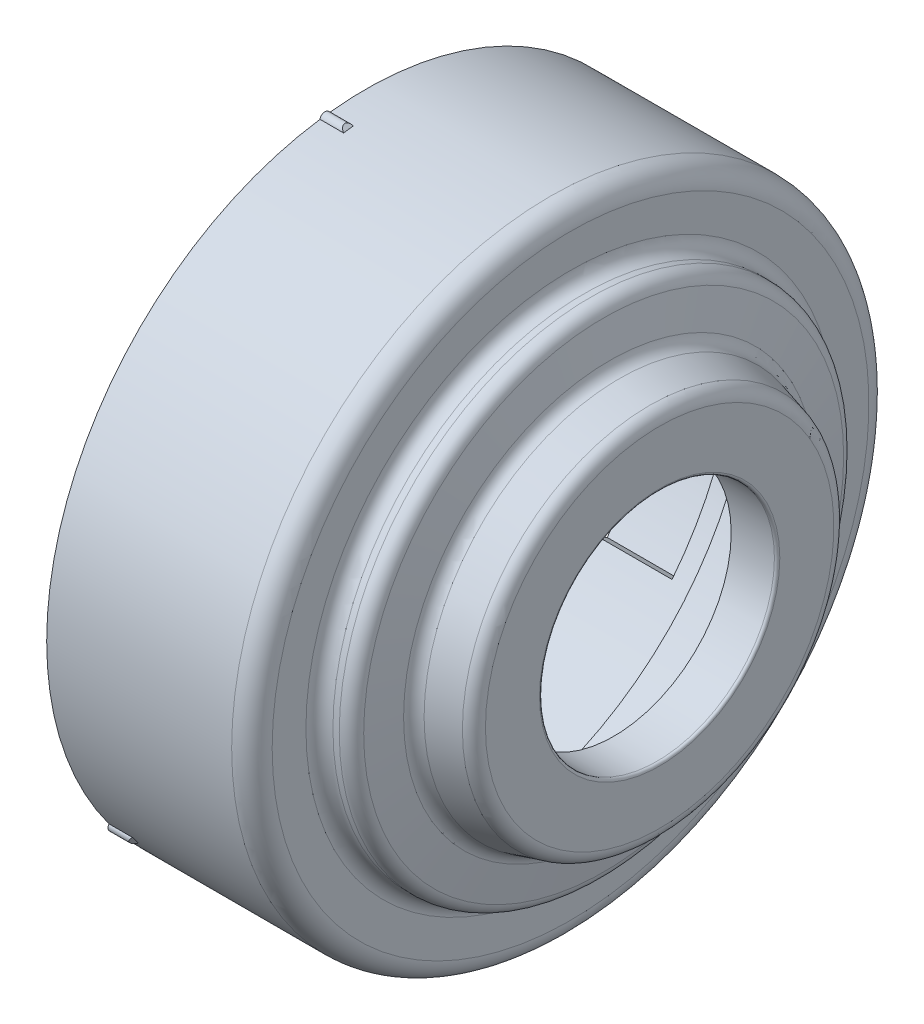
from build123d import *

# Parameters (mm, degrees)
FILLET_1_R               = 0.2
FILLET_2_R               = 1
FILLET_3_R               = 1.5
CUT_EXTRUDE_START        = -1
CUT_EXTRUDE_1_DEPTH      = 1
CUT_EXTRUDE_START_2      = -5.5
CUT_EXTRUDE_2_DEPTH      = 5.5
SKETCH_5_W               = 2.200000000000001
SKETCH_5_H               = 1.458146796235166
CUT_REVOLVE_1_ANGLE      = 24.000000000000053
CUT_EXTRUDE_3_REACH      = 51.835
CUT_EXTRUDE_3_END_RADIUS = 22.8
PATTERN_CIRCULAR_1_COUNT = 3
CUT_EXTRUDE_5_REACH      = 40.16
PATTERN_CIRCULAR_3_COUNT = 3
CUT_EXTRUDE_6_REACH      = 40.16
CUT_EXTRUDE_7_REACH      = 40.16
EXTRUDE_2_DEPTH          = 1.75
PATTERN_CIRCULAR_7_COUNT = 3


with BuildPart() as part:
    # 草图2 → 旋转1 (revolve)
    with BuildSketch(Plane.XY, mode=Mode.PRIVATE) as revolve_1_sk:
        Polygon((-13.999999999999998, 22), (-6.899999999999999, 22), (-6.899999999999999, 21.599999999999998), (1.73e-15, 21.599999999999998), (2.28e-15, 17.4), (2.500000000000002, 17.4), (3.157262574057294, 13.672478713033763), (6.600000000000001, 12.75), (6.600000000000003, 9.4), (4.400000000000003, 9.4), (4.400000000000003, 8.700000000000001), (7.800000000000003, 8.700000000000001), (7.800000000000003, 13.670792385574746), (4.206280569869923, 14.633726604702153), (3.506919557412737, 18.599999999999998), (1.200000000000002, 18.599999999999998), (1.2000000000000015, 23.599999999999998), (-13.999999999999998, 23.599999999999998), align=None)
    revolve(revolve_1_sk.sketch.rotate(Axis((-36.93660531697341, 0, 0), (1, 0, 0)), 90), axis=Axis((-36.93660531697341, 0, 0), (1, 0, 0)))

    # 圆角1
    fillet_1_edges = [part.edges().sort_by_distance(p)[0] for p in [
        (0, 4.55e-15, -21.599999999999998),
        (0, -4.06e-15, -17.4),
        (2.5, -4.06e-15, -17.4),
        (6.600000000000001, -2.98e-15, -12.75),
        (7.800000000000004, -2.03e-15, -8.700000000000001),
    ]]
    fillet(fillet_1_edges, radius=FILLET_1_R)

    # 圆角2
    fillet_2_edges = [part.edges().sort_by_distance(p)[0] for p in [
        (7.800000000000004, -3.19e-15, -13.670792385574746),
        (4.206280569869925, -3.42e-15, -14.633726604702153),
        (3.5069195574127363, -4.34e-15, -18.599999999999998),
        (1.2000000000000028, -4.34e-15, -18.599999999999998),
    ]]
    fillet(fillet_2_edges, radius=FILLET_2_R)

    # 圆角3
    fillet_3_edges = [part.edges().sort_by_distance(p)[0] for p in [
        (3.1572625740572917, -3.19e-15, -13.672478713033763),
        (1.2000000000000028, -5.51e-15, -23.599999999999998),
    ]]
    fillet(fillet_3_edges, radius=FILLET_3_R)

    # 草图3 → 切除-拉伸1 (cut)
    with BuildSketch(Plane.ZY.offset(13.999999999999998).offset(CUT_EXTRUDE_START)):
        with BuildLine():
            Line((-0.49999999999999933, 22.599999999999998), (0.5000000000000004, 22.599999999999998))
            Line((0.5000000000000004, 22.599999999999998), (0.5000000000000006, 21.99431744792277))
            ThreePointArc((0.5000000000000006, 21.99431744792277), (1.35e-15, 22), (-0.4999999999999993, 21.99431744792277))
            Line((-0.4999999999999993, 21.99431744792277), (-0.49999999999999933, 22.599999999999998))
        make_face()
    extrude(amount=CUT_EXTRUDE_1_DEPTH, mode=Mode.SUBTRACT)

    # 草图4 → 切除-拉伸2 (cut)
    with BuildSketch(Plane.ZY.offset(13.999999999999998).offset(CUT_EXTRUDE_START_2)):
        with BuildLine():
            Line((-3.2499999999999982, 22.56717749298747), (-3.2499999999999987, 21.75861898191151))
            ThreePointArc((-3.2499999999999987, 21.75861898191151), (1.35e-15, 21.999999999999996), (3.2500000000000013, 21.75861898191151))
            Line((3.2500000000000013, 21.75861898191151), (3.2500000000000018, 22.567177492987465))
            ThreePointArc((3.2500000000000018, 22.567177492987465), (1.4e-15, 22.8), (-3.2499999999999982, 22.56717749298747))
        make_face()
    cut_extrude_2 = extrude(amount=CUT_EXTRUDE_2_DEPTH, mode=Mode.SUBTRACT)

    # 草图5 → 切除-旋转1 (revolve, cut)
    with BuildSketch(Plane.XY):
        with Locations((-9.599999999999994, 22.070926601882412)):
            Rectangle(SKETCH_5_W, SKETCH_5_H)
    cut_revolve_1 = revolve(axis=Axis((16.624194515447005, 0, 0), (1, 0, 0)), revolution_arc=CUT_REVOLVE_1_ANGLE, mode=Mode.SUBTRACT)

    # 切除-拉伸3: up to this cylinder (the profile starts inside it)
    cut_extrude_3_end = Plane(origin=(-10.733154, 0, 0), z_dir=(-1, 0, 0)) * Cylinder(CUT_EXTRUDE_3_END_RADIUS, 150.27, mode=Mode.PRIVATE)
    # 草图6 → 切除-拉伸3 (cut, up to the surface)
    with BuildSketch(Plane(origin=(0, 18, 0), x_dir=(1, 0, 0), z_dir=(0, 1, 0)), mode=Mode.PRIVATE) as cut_extrude_3_sk1:
        Polygon((-10.699999999999994, -8.948206147667621), (-10.699999999999994, -3.2500000000000013), (-10.799462558281862, -8.948206147667621), align=None)
    cut_extrude_3_tool1 = extrude(cut_extrude_3_sk1.sketch, amount=CUT_EXTRUDE_3_REACH, mode=Mode.PRIVATE) & cut_extrude_3_end
    cut_extrude_3 = cut_extrude_3_tool1.solids().sort_by_distance((-10.733154, 18, 7.048804))[0]
    add(cut_extrude_3, mode=Mode.SUBTRACT)

    # 阵列(圆周)1: 切除-拉伸2, 切除-旋转1 ×3 about axis
    pattern_circular_1_axis = Axis((0, 1e-17, 1.4e-16), (1, 0, 0))
    add([cut_extrude_2.rotate(pattern_circular_1_axis, i * 360 / PATTERN_CIRCULAR_1_COUNT) for i in range(1, PATTERN_CIRCULAR_1_COUNT)], mode=Mode.SUBTRACT)
    add([cut_revolve_1.rotate(pattern_circular_1_axis, i * 360 / PATTERN_CIRCULAR_1_COUNT) for i in range(1, PATTERN_CIRCULAR_1_COUNT)], mode=Mode.SUBTRACT)

    # 切除-拉伸5: up to this face of the body (flat: up to its plane)
    cut_extrude_5_end = Plane(part.part.faces().sort_by_distance((-10.750360581, 21.4748312, 6.135155752))[0])
    # 草图9 → 切除-拉伸5 (cut, up to the picked face)
    with BuildSketch(Plane(origin=(-10.699999999999994, 0, 0), x_dir=(0, 0, -1), z_dir=(1, 0, 0)), mode=Mode.PRIVATE) as cut_extrude_5_sk1:
        with BuildLine():
            Line((-9.273595462128261, 20.82883643425129), (-8.948206147667621, 20.09800006813721))
            Line((-8.948206147667621, 20.09800006813721), (-8.948206147667618, 20.970684460428163))
            ThreePointArc((-8.948206147667618, 20.970684460428163), (-9.111176855506788, 20.90039368786333), (-9.273595462128261, 20.82883643425129))
        make_face()
    cut_extrude_5_tool1 = split(extrude(cut_extrude_5_sk1.sketch, amount=-CUT_EXTRUDE_5_REACH, mode=Mode.PRIVATE), bisect_by=cut_extrude_5_end, keep=Keep.BOTH, mode=Mode.PRIVATE)
    add(cut_extrude_5_tool1.solids().sort_by(Axis((-10.7, 20.632815, 9.056732), (-1, 0, 0)))[0], mode=Mode.SUBTRACT)

    # 阵列(圆周)3: 切除-拉伸3 ×3 about axis
    pattern_circular_3_axis = Axis((0, 0, 6.626e-14), (1, 0, 0))
    for i in range(1, PATTERN_CIRCULAR_3_COUNT):
        add(cut_extrude_3.rotate(pattern_circular_3_axis, i * 360 / PATTERN_CIRCULAR_3_COUNT), mode=Mode.SUBTRACT)

    # 切除-拉伸6: up to this face of the body (flat: up to its plane)
    cut_extrude_6_end = Plane(part.part.faces().sort_by_distance((-10.750360581, -5.424214863, -21.665327237))[0])
    # 草图10 → 切除-拉伸6 (cut, up to the picked face)
    with BuildSketch(Plane(origin=(-10.699999999999994, 0, 0), x_dir=(0, 0, -1), z_dir=(1, 0, 0)), mode=Mode.PRIVATE) as cut_extrude_6_sk1:
        with BuildLine():
            Line((22.675099214396656, -2.383248962502268), (21.879481698102033, -2.2996261918881546))
            Line((21.879481698102033, -2.2996261918881546), (22.63524855131219, -2.7359683880336263))
            ThreePointArc((22.63524855131219, -2.7359683880336263), (22.655860310538994, -2.5596862286897593), (22.675099214396656, -2.383248962502268))
        make_face()
    cut_extrude_6_tool1 = split(extrude(cut_extrude_6_sk1.sketch, amount=-CUT_EXTRUDE_6_REACH, mode=Mode.PRIVATE), bisect_by=cut_extrude_6_end, keep=Keep.BOTH, mode=Mode.PRIVATE)
    add(cut_extrude_6_tool1.solids().sort_by(Axis((-10.7, -2.473048, -22.396907), (-1, 0, 0)))[0], mode=Mode.SUBTRACT)

    # 切除-拉伸7: up to this face of the body (flat: up to its plane)
    cut_extrude_7_end = Plane(part.part.faces().sort_by_distance((-10.750360581, -16.050616337, 15.530171486))[0])
    # 草图11 → 切除-拉伸7 (cut, up to the picked face)
    with BuildSketch(Plane(origin=(-10.699999999999994, 0, 0), x_dir=(0, 0, -1), z_dir=(1, 0, 0)), mode=Mode.PRIVATE) as cut_extrude_7_sk1:
        with BuildLine():
            Line((-13.401503752268288, -18.445587471748876), (-12.93127555043432, -17.79837387624892))
            Line((-12.93127555043432, -17.79837387624892), (-13.687042403644462, -18.234716072394395))
            ThreePointArc((-13.687042403644462, -18.234716072394395), (-13.5446834550321, -18.340707459173426), (-13.401503752268288, -18.445587471748876))
        make_face()
    cut_extrude_7_tool1 = split(extrude(cut_extrude_7_sk1.sketch, amount=-CUT_EXTRUDE_7_REACH, mode=Mode.PRIVATE), bisect_by=cut_extrude_7_end, keep=Keep.BOTH, mode=Mode.PRIVATE)
    add(cut_extrude_7_tool1.solids().sort_by(Axis((-10.7, -18.159767, 13.340176), (-1, 0, 0)))[0], mode=Mode.SUBTRACT)

    # 草图14 → 凸台-拉伸2 (add)
    with BuildSketch(Plane.ZY.offset(13.999999999999998)):
        with BuildLine():
            ThreePointArc((3.3581804234219934, 23.359850689671486), (3.0000000000000195, 23.408545448190495), (2.6411157680717094, 23.451748495573703))
            ThreePointArc((2.6411157680717094, 23.451748495573703), (3.0330508474576368, 23.66643620312819), (3.3581804234219934, 23.359850689671486))
        make_face()
    extrude_2 = extrude(amount=-EXTRUDE_2_DEPTH)

    # 阵列(圆周)7: 凸台-拉伸2 ×3 about axis
    pattern_circular_7_axis = Axis((0, -1.44e-15, 1.48e-15), (1, 0, 0))
    for i in range(1, PATTERN_CIRCULAR_7_COUNT):
        add(extrude_2.rotate(pattern_circular_7_axis, i * 360 / PATTERN_CIRCULAR_7_COUNT))

    # 草图15 → 切除-旋转2 (revolve, cut)
    with BuildSketch(Plane(origin=(0, 0, 0), x_dir=(-1, 0, 0), z_dir=(0, 0.12706460860134405, -0.9918944425900305)), mode=Mode.PRIVATE) as cut_revolve_2_sk:
        Polygon((12.249999999999996, 23.599999999999994), (12.249999999999996, 23.963113909123802), (12.61311390912379, 23.963113909123795), align=None)
    revolve(cut_revolve_2_sk.sketch.rotate(Axis((0, 0, 0), (-1, 0, 0)), 97.3), axis=Axis((0, 0, 0), (-1, 0, 0)), mode=Mode.SUBTRACT)


solid = part.part
